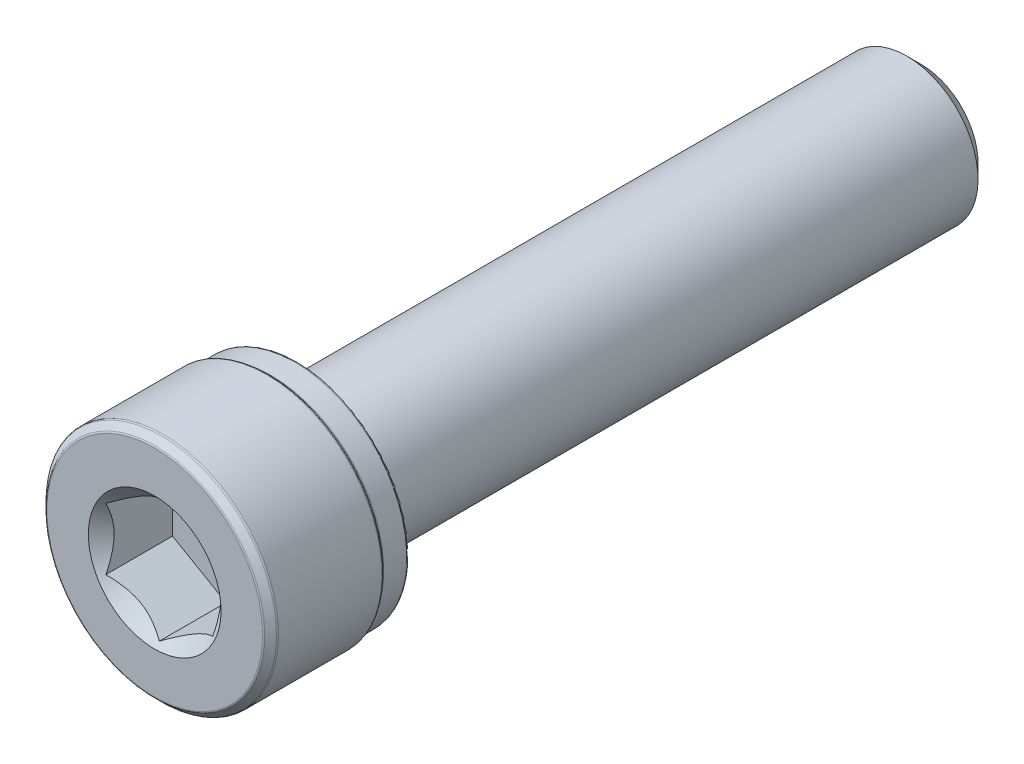
from build123d import *

# Parameters (mm, degrees)
CUT_EXTRUDE1_START = -4
CUT_EXTRUDE1_DEPTH = 4


with BuildPart() as part:
    # Sketch2 → Revolve1 (revolve)
    with BuildSketch(Plane(origin=(0, 0, 0), x_dir=(0, 0, -1), z_dir=(1, 0, 0))):
        with BuildLine():
            Line((-21.5, 0), (-21.5, 6.048223305))
            ThreePointArc((-21.5, 6.048223305), (-21.490484942, 6.096058734), (-21.463388348, 6.136611652))
            Line((-21.463388348, 6.136611652), (-21.136611652, 6.463388348))
            ThreePointArc((-21.136611652, 6.463388348), (-21.096058734, 6.490484942), (-21.048223305, 6.5))
            Line((-21.048223305, 6.5), (-15.251776695, 6.5))
            ThreePointArc((-15.251776695, 6.5), (-15.203941266, 6.490484942), (-15.163388348, 6.463388348))
            Line((-15.163388348, 6.463388348), (-15.036611652, 6.336611652))
            ThreePointArc((-15.036611652, 6.336611652), (-14.996058734, 6.309515058), (-14.948223305, 6.3))
            Line((-14.948223305, 6.3), (-13.6625, 6.3))
            ThreePointArc((-13.6625, 6.3), (-13.547595148, 6.252404852), (-13.5, 6.1375))
            Line((-13.5, 6.1375), (-13.5, 4.4))
            ThreePointArc((-13.5, 4.4), (-13.382842712, 4.117157288), (-13.1, 4))
            Line((-13.1, 4), (20.688101184, 4))
            Line((20.688101184, 4), (21.5, 3.188101184))
            Line((21.5, 3.188101184), (21.5, 0))
            Line((21.5, 0), (-21.5, 0))
        make_face()
    revolve(axis=Axis((0, 0, -21.5), (0, 0, 1)))

    # Sketch3 → Cut-Extrude1 (cut)
    with BuildSketch(Plane.XY.offset(21.5).offset(CUT_EXTRUDE1_START)):
        Polygon((3, -1.732050808), (3, 1.732050808), (0, 3.464101615), (-3, 1.732050808), (-3, -1.732050808), (0, -3.464101615), align=None)
    extrude(amount=CUT_EXTRUDE1_DEPTH, mode=Mode.SUBTRACT)

    # Cut-Extrude2 cone 1 section (through the dimple's axis) → Cut-Extrude2 (revolve, cut)
    with BuildSketch(Plane(origin=(0, 0, 21.5), x_dir=(0, -1, 0), z_dir=(1, 0, 0))):
        Polygon((0, 0), (3.723909236, 0), (0, 3.723909236), align=None)
    revolve(axis=Axis((0, 0, 21.5), (0, 0, -1)), mode=Mode.SUBTRACT)


solid = part.part
